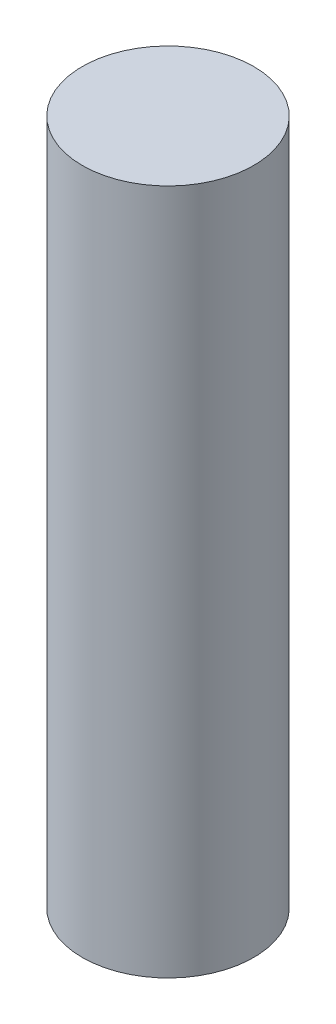
from build123d import *

# Parameters (mm, degrees)
SKETCH1_R           = 6.35
BOSS_EXTRUDE1_DEPTH = 50.8


with BuildPart() as part:
    # Sketch1 → Boss-Extrude1 (new body)
    with BuildSketch(Plane(origin=(0, 0, 0), x_dir=(1, 0, 0), z_dir=(0, 1, 0))):
        with Locations(Location((0, 0, 0), (0, 0, 270))):
            Circle(SKETCH1_R)
    extrude(amount=BOSS_EXTRUDE1_DEPTH)


solid = part.part
